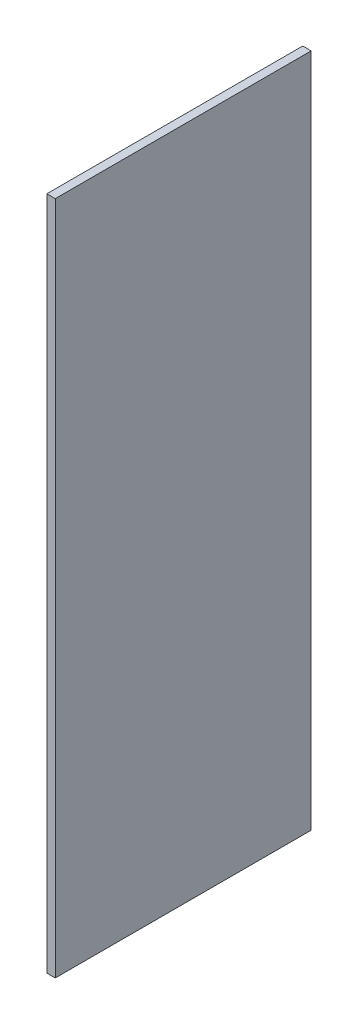
from build123d import *

# Parameters (mm, degrees)
SKETCH2_W           = 2275
SKETCH2_H           = 6000
BOSS_EXTRUDE1_DEPTH = 75


with BuildPart() as part:
    # Sketch2 → Boss-Extrude1 (new body)
    with BuildSketch(Plane(origin=(0, 0, 0), x_dir=(0, 0, -1), z_dir=(1, 0, 0))):
        Rectangle(SKETCH2_W, SKETCH2_H)
    extrude(amount=BOSS_EXTRUDE1_DEPTH)


solid = part.part
